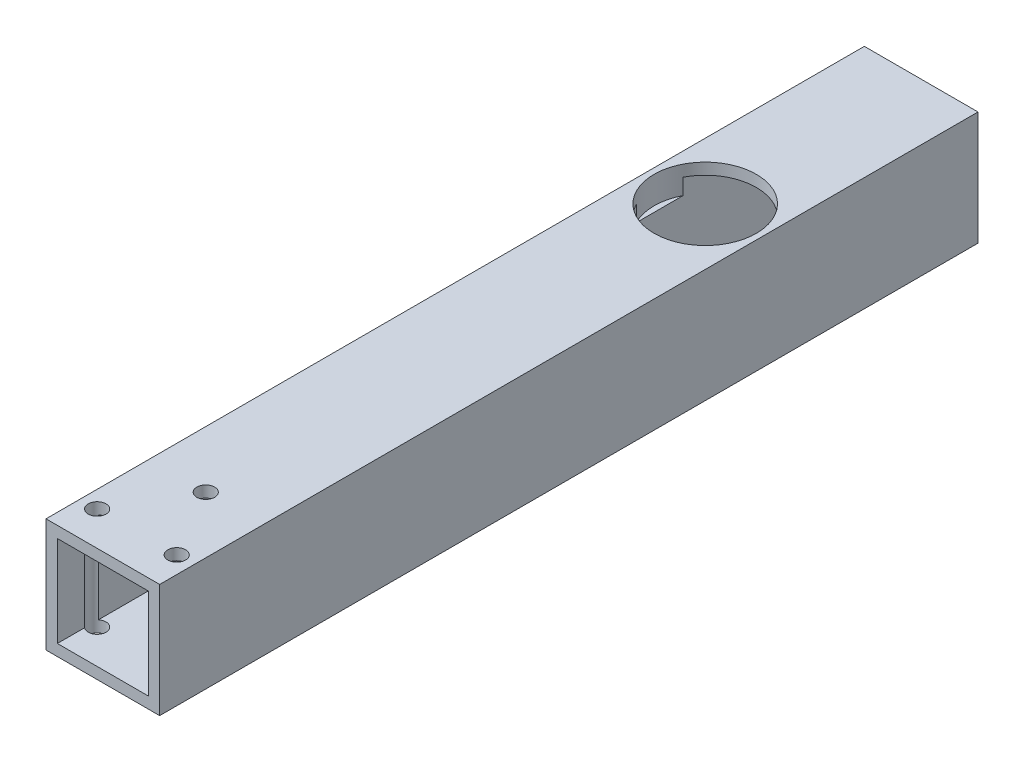
from build123d import *

# Parameters (mm, degrees)
BOSS_EXTRUDE1_DEPTH      = 114.3
BOSS_EXTRUDE1_DEPTH_BACK = 114.3
SKETCH3_W                = 31.75
SKETCH3_H                = 31.75
SKETCH3_W_2              = 25.4
SKETCH3_H_2              = 25.4
F_10_CLEARANCE_HOLE1_D   = 4.9784
SKETCH7_R                = 14.2875
CUT_EXTRUDE1_DEPTH       = 7.62
CUT_EXTRUDE2_START       = -7.62
SKETCH8_R                = 14.2875
CUT_EXTRUDE2_DEPTH       = 7.62


with BuildPart() as part:
    # Sketch3 → Boss-Extrude1 (new, two sides: drawn at the far end of the back side and taken through both)
    with BuildSketch(Plane.XY.offset(-BOSS_EXTRUDE1_DEPTH_BACK)):
        Rectangle(SKETCH3_W, SKETCH3_H)
        Rectangle(SKETCH3_W_2, SKETCH3_H_2, mode=Mode.SUBTRACT)
    extrude(amount=BOSS_EXTRUDE1_DEPTH + BOSS_EXTRUDE1_DEPTH_BACK)

    # #10 Clearance Hole1 (through all)
    with Locations(Plane(origin=(0, 15.875, 0), x_dir=(1, 0, 0), z_dir=(0, 1, 0))):
        with Locations((-11.1125, -104.775), (11.1125, -104.775), (0, -85.5472)):
            Hole(F_10_CLEARANCE_HOLE1_D / 2)

    # Sketch7 → Cut-Extrude1 (cut)
    with BuildSketch(Plane(origin=(0, 15.875, 0), x_dir=(1, 0, 0), z_dir=(0, 1, 0))):
        with Locations(Location((0, 53.975, 0), (0, 0, 270))):
            Circle(SKETCH7_R)
    extrude(amount=-CUT_EXTRUDE1_DEPTH, mode=Mode.SUBTRACT)

    # Sketch8 → Cut-Extrude2 (cut)
    with BuildSketch(Plane.XZ.offset(15.875).offset(CUT_EXTRUDE2_START)):
        with Locations(Location((0, -53.975, 0), (0, 0, 90))):
            Circle(SKETCH8_R)
    extrude(amount=CUT_EXTRUDE2_DEPTH, mode=Mode.SUBTRACT)


solid = part.part
